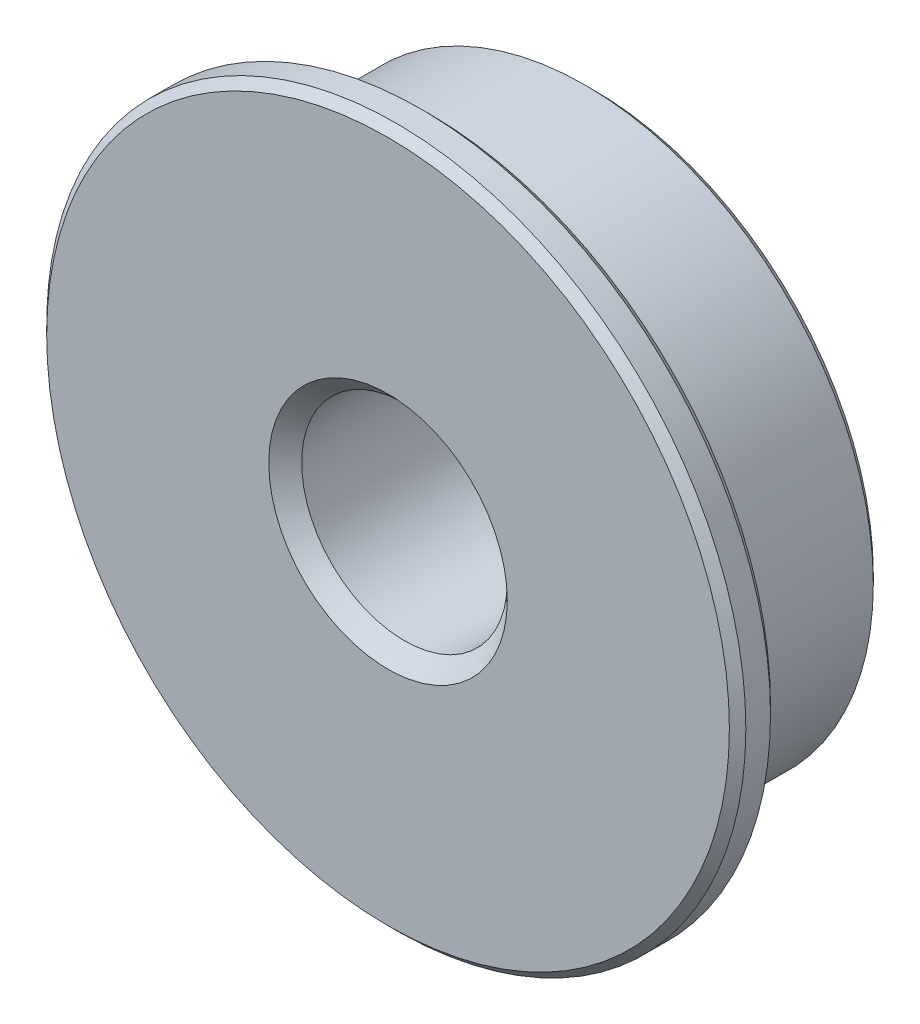
from build123d import *

# Parameters (mm, degrees)
SKETCH_1_R      = 7
SKETCH_1_R_2    = 2.5
EXTRUDE_1_DEPTH = 2.5
EXTRUDE_START   = -1
SKETCH_2_R      = 8.5
SKETCH_2_R_2    = 2.5
EXTRUDE_2_DEPTH = 1
CHAMFER_1_SIZE  = 0.2
CHAMFER_2_SIZE  = 0.4


with BuildPart() as part:
    # 草图1 → 凸台-拉伸1 (new, symmetric)
    with BuildSketch(Plane.XY):
        Circle(SKETCH_1_R)
        Circle(SKETCH_1_R_2, mode=Mode.SUBTRACT)
    extrude(amount=EXTRUDE_1_DEPTH, both=True)

    # 草图2 → 凸台-拉伸2 (add)
    with BuildSketch(Plane.XY.offset(2.5).offset(EXTRUDE_START)):
        Circle(SKETCH_2_R)
        Circle(SKETCH_2_R_2, mode=Mode.SUBTRACT)
    extrude(amount=EXTRUDE_2_DEPTH)

    # 倒角1
    chamfer_1_edges = [part.edges().sort_by_distance(p)[0] for p in [
        (-8.5, 0, 2.5),
        (-8.5, 0, 1.5),
        (-7, 0, -2.5),
    ]]
    chamfer(chamfer_1_edges, length=CHAMFER_1_SIZE)

    # 倒角2
    chamfer_2_edges = [part.edges().sort_by_distance(p)[0] for p in [
        (-2.5, 0, -2.5),
        (-2.5, 0, 2.5),
    ]]
    chamfer(chamfer_2_edges, length=CHAMFER_2_SIZE)


solid = part.part
